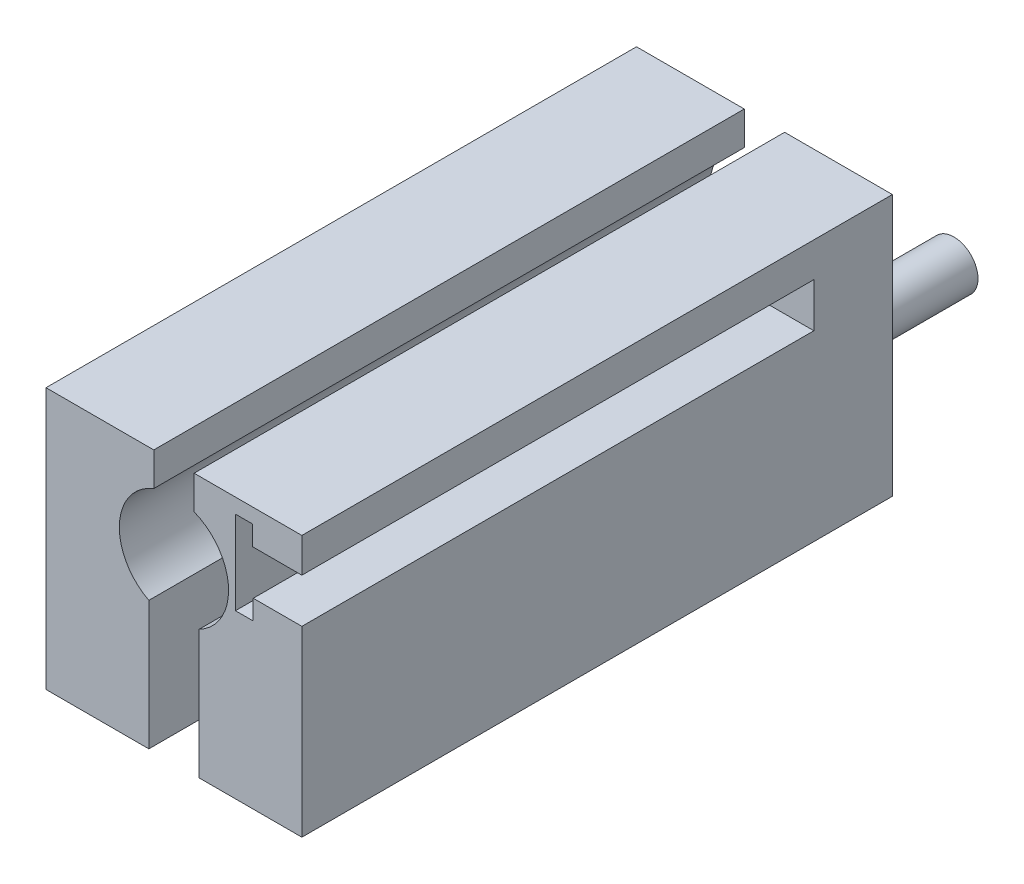
from build123d import *

# Parameters (mm, degrees)
SKETCH_2_W               = 52
SKETCH_2_H               = 120
EXTRUDE_1_DEPTH          = 7.5
SKETCH_3_R               = 11.1
EXTRUDE_2_DEPTH          = 60
CUT_EXTRUDE_1_DEPTH      = 81.007562143
CUT_EXTRUDE_1_DEPTH_BACK = 81.007562143
SKETCH_4_W               = 8.2
SKETCH_4_H               = 8.069924866
SKETCH_5_W               = 10.2
SKETCH_5_H               = 26.140993965
CUT_EXTRUDE_2_DEPTH      = 70
SKETCH_6_R               = 4.9
EXTRUDE_3_DEPTH          = 25
EXTRUDE_4_DEPTH          = 120
CUT_EXTRUDE_3_DEPTH      = 104.044523


with BuildPart() as part:
    # 스케치2 → 보스-돌출1 (new, symmetric)
    with BuildSketch(Plane(origin=(0, 0, 0), x_dir=(1, 0, 0), z_dir=(0, 1, 0))):
        Rectangle(SKETCH_2_W, SKETCH_2_H)
    extrude(amount=EXTRUDE_1_DEPTH, both=True)

    # 스케치3 → 보스-돌출2 (add, symmetric)
    with BuildSketch(Plane.XY):
        with BuildLine():
            Line((-26, 32.5), (-26, 7.5))
            Line((-26, 7.5), (26, 7.5))
            Line((26, 7.5), (26, 32.5))
            Line((26, 32.5), (9.6493822, 43.219015699))
            ThreePointArc((9.6493822, 43.219015699), (0, 46.1), (-9.6493822, 43.219015699))
            Line((-9.6493822, 43.219015699), (-26, 32.5))
        make_face()
        with Locations((0, 28.5)):
            Circle(SKETCH_3_R, mode=Mode.SUBTRACT)
    extrude(amount=EXTRUDE_2_DEPTH, both=True)

    # 스케치4 → 컷-돌출1 (cut, two sides: drawn at the far end of the back side and taken through both)
    with BuildSketch(Plane.XY.offset(-CUT_EXTRUDE_1_DEPTH_BACK)):
        with Locations((0, 42.85)):
            Rectangle(SKETCH_4_W, SKETCH_4_H)
    extrude(amount=CUT_EXTRUDE_1_DEPTH + CUT_EXTRUDE_1_DEPTH_BACK, mode=Mode.SUBTRACT)

    # 스케치5 → 컷-돌출2 (cut)
    with BuildSketch(Plane.XY.offset(60)):
        with Locations((0, 5.570496982)):
            Rectangle(SKETCH_5_W, SKETCH_5_H)
    extrude(amount=-CUT_EXTRUDE_2_DEPTH, mode=Mode.SUBTRACT)

    # 스케치6 → 보스-돌출3 (add)
    with BuildSketch(Plane(origin=(0, 0, -60), x_dir=(-1, 0, 0), z_dir=(0, 0, -1))):
        with Locations(Location((13.5, 14.5, 0), (0, 0, 180))):
            Circle(SKETCH_6_R)
        with Locations(Location((-13.5, 14.5, 0), (0, 0, 180))):
            Circle(SKETCH_6_R)
    extrude(amount=EXTRUDE_3_DEPTH)

    # 스케치9 → 보스-돌출4 (add)
    with BuildSketch(Plane.XY.offset(60)):
        Polygon((4.1, 45.615782191), (6.978359415, 44.657428628), (26, 32.5), (26, 45.615782191), align=None)
        Polygon((-26, 45.615782191), (-4.1, 45.615782191), (-6.978359415, 44.657428628), (-26, 32.5), align=None)
    extrude(amount=-EXTRUDE_4_DEPTH)

    # 스케치13 → 컷-돌출3 (cut)
    with BuildSketch(Plane.XY.offset(60)):
        Polygon((26, 38.615782191), (16, 38.615782191), (16, 42.615782191), (12.5, 42.615782191), (12.5, 25.615782191), (16.116710555, 25.615782191), (16.116710555, 29.615782191), (26, 29.615782191), align=None)
    extrude(amount=-CUT_EXTRUDE_3_DEPTH, mode=Mode.SUBTRACT)


solid = part.part
